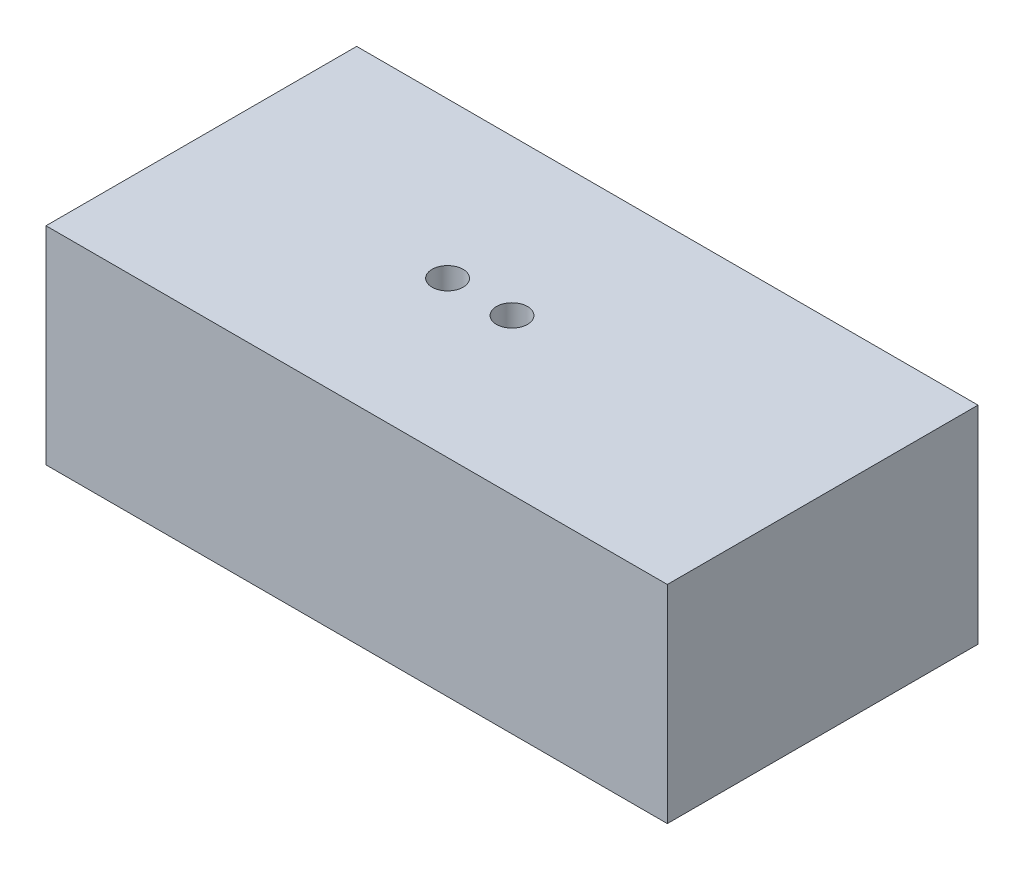
from build123d import *

# Parameters (mm, degrees)
SKETCH1_W           = 30
SKETCH1_H           = 15
SKETCH1_R           = 0.75
BOSS_EXTRUDE1_DEPTH = 10


with BuildPart() as part:
    # Sketch1 → Boss-Extrude1 (new body)
    with BuildSketch(Plane(origin=(0, 0, 0), x_dir=(1, 0, 0), z_dir=(0, 1, 0))):
        Rectangle(SKETCH1_W, SKETCH1_H)
        with Locations(Location((0, 0, 0), (0, 0, 270))):
            Circle(SKETCH1_R, mode=Mode.SUBTRACT)
        with Locations(Location((-3.11, 0, 0), (0, 0, 270))):
            Circle(SKETCH1_R, mode=Mode.SUBTRACT)
    extrude(amount=BOSS_EXTRUDE1_DEPTH)


solid = part.part
